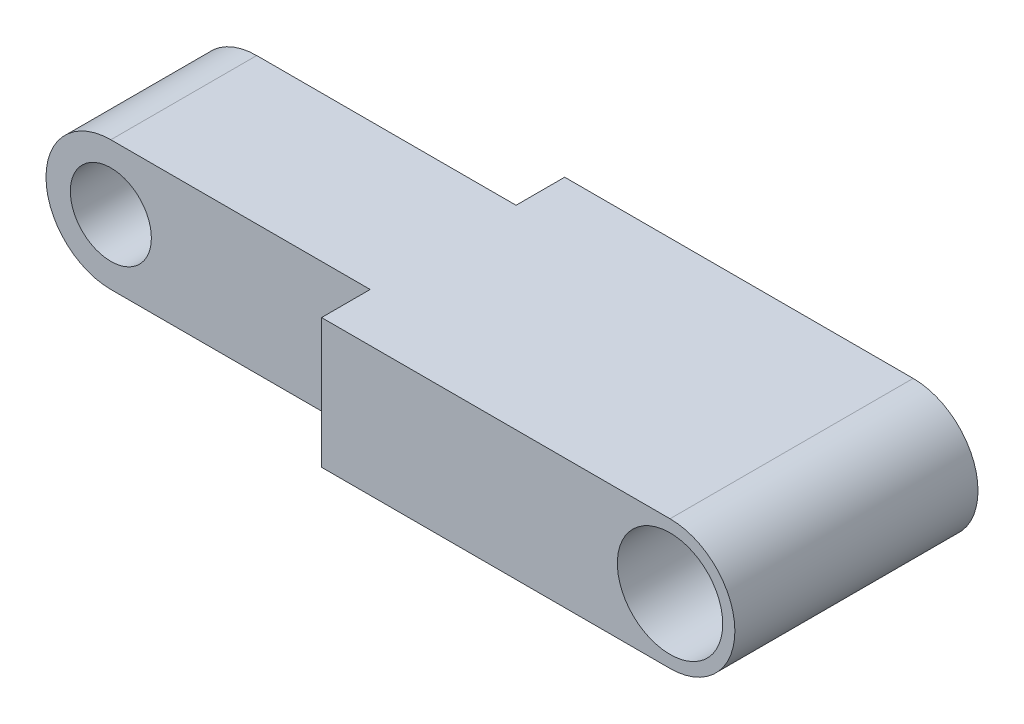
from build123d import *

# Parameters (mm, degrees)
EXTRUDE_1_DEPTH     = 60
SKETCH_2_R          = 13
CUT_EXTRUDE_1_DEPTH = 25
CUT_EXTRUDE_3_REACH = 100.803
SKETCH_3_R          = 8.25
CUT_EXTRUDE_4_REACH = 112.168
SKETCH_4_R          = 10
CUT_EXTRUDE_START   = -12
CUT_EXTRUDE_5_DEPTH = 12


with BuildPart() as part:
    # 草图1 → 凸台-拉伸1 (new body)
    with BuildSketch(Plane.XY):
        with BuildLine():
            Line((-75, 16), (75, 16))
            ThreePointArc((75, 16), (91, 0), (75, -16))
            Line((75, -16), (-75, -16))
            ThreePointArc((-75, -16), (-91, 0), (-75, 16))
        make_face()
    extrude(amount=EXTRUDE_1_DEPTH)

    # 草图2 → 切除-拉伸1 (cut)
    with BuildSketch(Plane.XY.offset(60)):
        with Locations((75, 0)):
            Circle(SKETCH_2_R)
    extrude(amount=-CUT_EXTRUDE_1_DEPTH, mode=Mode.SUBTRACT)

    # 草图3 → 切除-拉伸3 (cut, up to next)
    with BuildSketch(Plane.XY.offset(35), mode=Mode.PRIVATE) as cut_extrude_3_sk1:
        with Locations((75, 0)):
            Circle(SKETCH_3_R)
    cut_extrude_3_tool1 = extrude(cut_extrude_3_sk1.sketch, amount=-CUT_EXTRUDE_3_REACH, mode=Mode.PRIVATE) & part.part
    add(cut_extrude_3_tool1.solids().sort_by_distance((75, 0, 35))[0], mode=Mode.SUBTRACT)

    # 草图4 → 切除-拉伸4 (cut, up to next)
    with BuildSketch(Plane.XY.offset(60), mode=Mode.PRIVATE) as cut_extrude_4_sk1:
        with Locations((-75, 0)):
            Circle(SKETCH_4_R)
    cut_extrude_4_tool1 = extrude(cut_extrude_4_sk1.sketch, amount=-CUT_EXTRUDE_4_REACH, mode=Mode.PRIVATE) & part.part
    add(cut_extrude_4_tool1.solids().sort_by_distance((-75, 0, 60))[0], mode=Mode.SUBTRACT)

    # 草图5 → 切除-拉伸5 (cut)
    with BuildSketch(Plane.XY.offset(60).offset(CUT_EXTRUDE_START)):
        with BuildLine():
            Line((-11, 16), (-11, -16))
            Line((-11, -16), (-75, -16))
            ThreePointArc((-75, -16), (-91, 0), (-75, 16))
            Line((-75, 16), (-11, 16))
        make_face()
    cut_extrude_5 = extrude(amount=CUT_EXTRUDE_5_DEPTH, mode=Mode.SUBTRACT)

    # 镜向1: 切除-拉伸5 across plane
    add(cut_extrude_5.mirror(Plane.XY.offset(30)), mode=Mode.SUBTRACT)


solid = part.part
